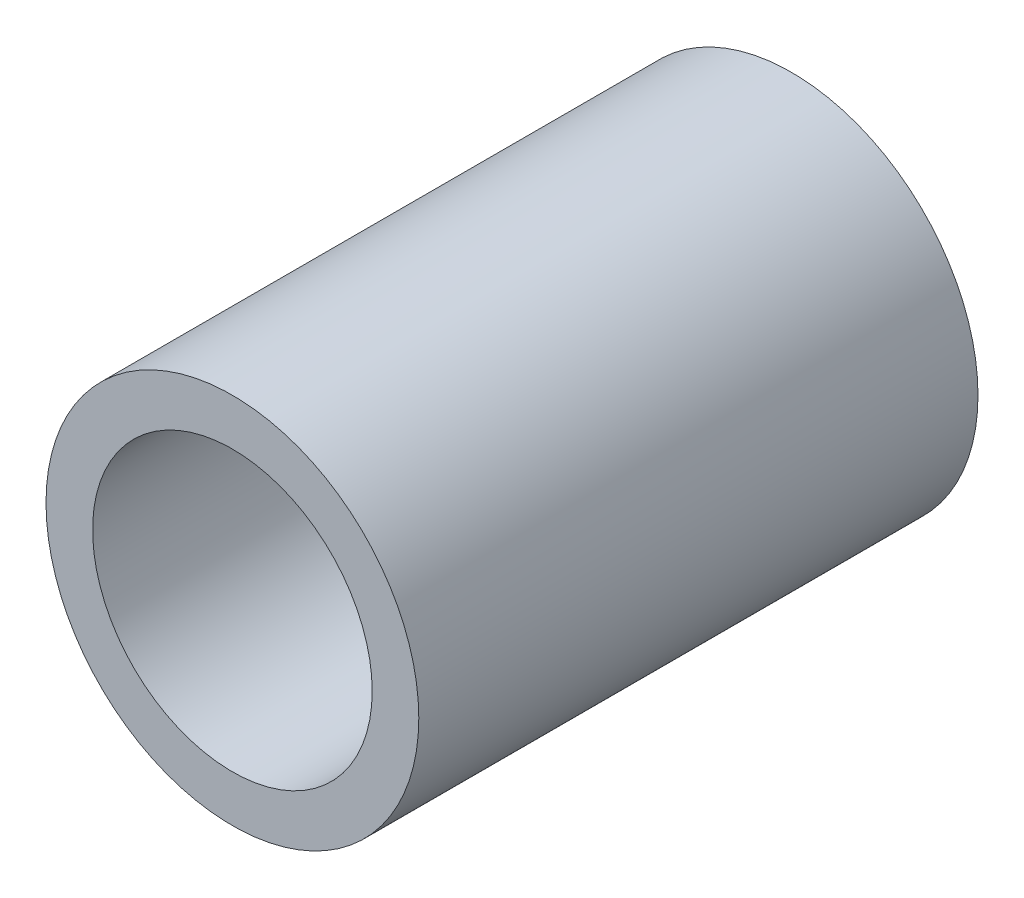
from build123d import *

# Parameters (mm, degrees)
ESQUISSE1_R        = 40
ESQUISSE1_R_2      = 30
BOSS_EXTRU_1_DEPTH = 120


with BuildPart() as part:
    # Esquisse1 → Boss.-Extru.1 (new body)
    with BuildSketch(Plane.XY):
        Circle(ESQUISSE1_R)
        Circle(ESQUISSE1_R_2, mode=Mode.SUBTRACT)
    extrude(amount=BOSS_EXTRU_1_DEPTH)


solid = part.part
